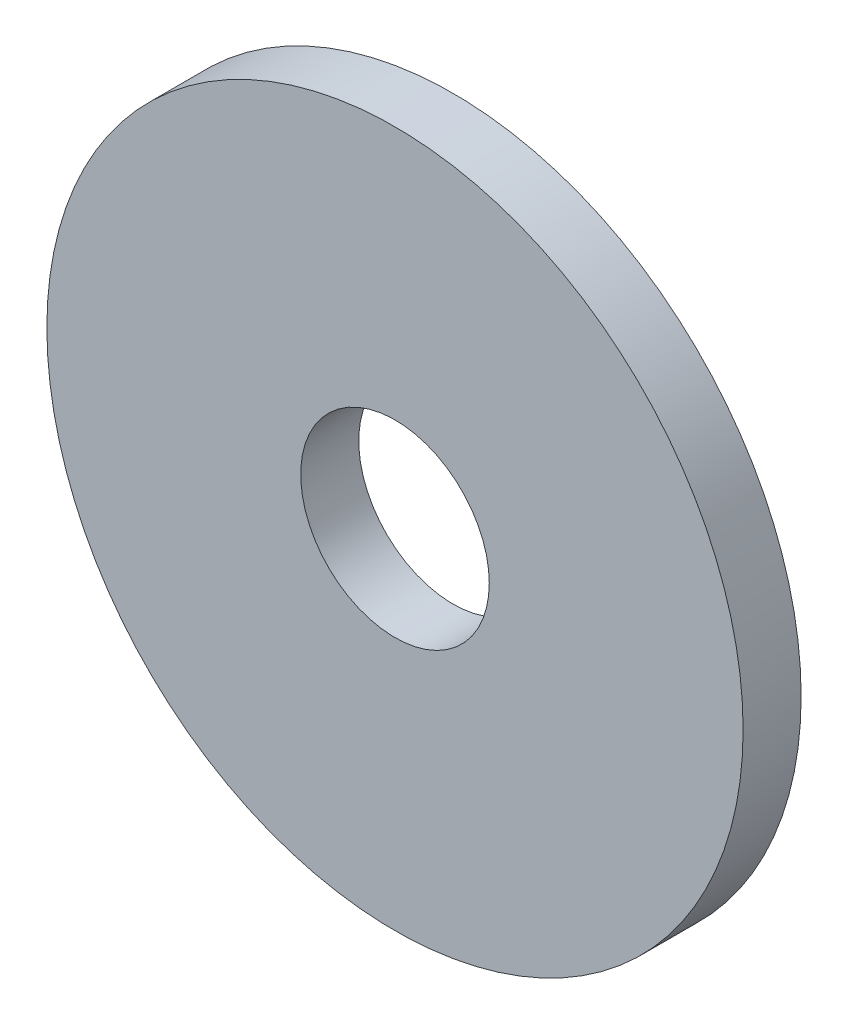
from build123d import *

# Parameters (mm, degrees)
ESBO_O1_R                = 6
ESBO_O1_R_2              = 1.625
RESSALTO_EXTRUS_O1_DEPTH = 1


with BuildPart() as part:
    # Esboço1 → Ressalto-extrusão1 (new body)
    with BuildSketch(Plane.XY):
        Circle(ESBO_O1_R)
        Circle(ESBO_O1_R_2, mode=Mode.SUBTRACT)
    extrude(amount=RESSALTO_EXTRUS_O1_DEPTH)


solid = part.part
